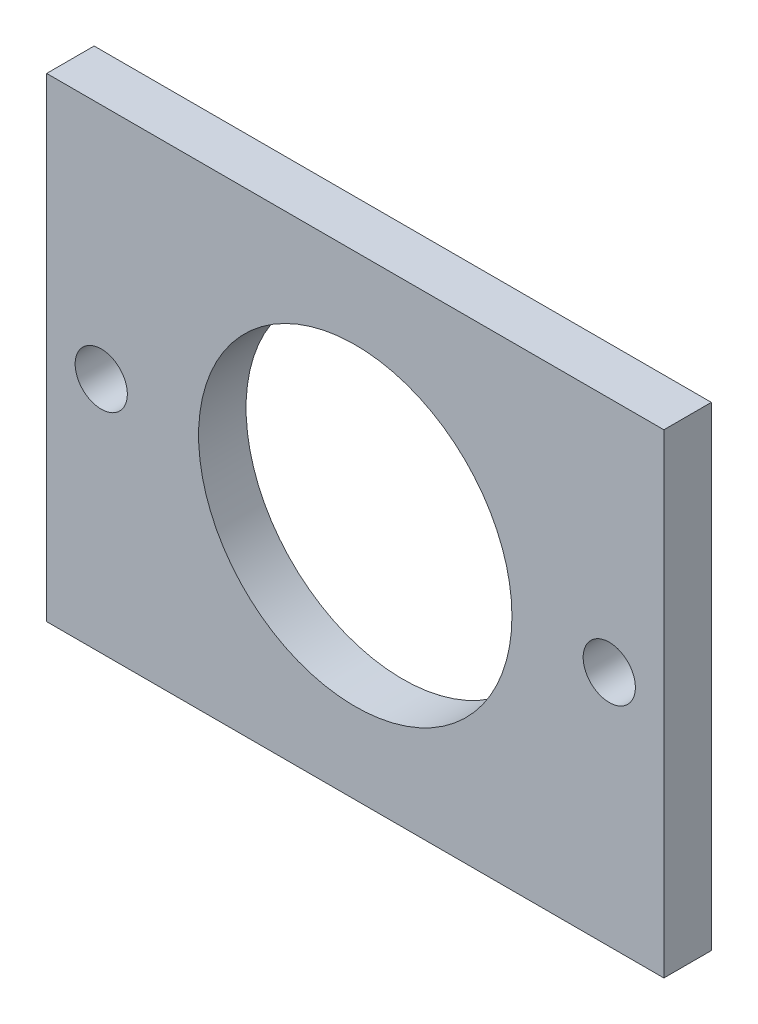
from build123d import *

# Parameters (mm, degrees)
CAP_PLATE_26X20X2_START       = 7.2
CAP_PLATE_26X20X2_PROFILE_W   = 26
CAP_PLATE_26X20X2_PROFILE_H   = 20
CAP_PLATE_26X20X2_PROFILE_R   = 6.6
CAP_PLATE_26X20X2_PROFILE_R_2 = 1.1
CAP_PLATE_26X20X2_DEPTH       = 2


with BuildPart() as part:
    # Cap_plate_26x20x2_Profile → Cap_plate_26x20x2 (new body)
    with BuildSketch(Plane.XY.offset(CAP_PLATE_26X20X2_START)):
        with Locations((12.5, 0)):
            Rectangle(CAP_PLATE_26X20X2_PROFILE_W, CAP_PLATE_26X20X2_PROFILE_H)
        with Locations((12.5, 0)):
            Circle(CAP_PLATE_26X20X2_PROFILE_R, mode=Mode.SUBTRACT)
        with Locations((1.8, 0)):
            Circle(CAP_PLATE_26X20X2_PROFILE_R_2, mode=Mode.SUBTRACT)
        with Locations((23.2, 0)):
            Circle(CAP_PLATE_26X20X2_PROFILE_R_2, mode=Mode.SUBTRACT)
    extrude(amount=CAP_PLATE_26X20X2_DEPTH)


solid = part.part
